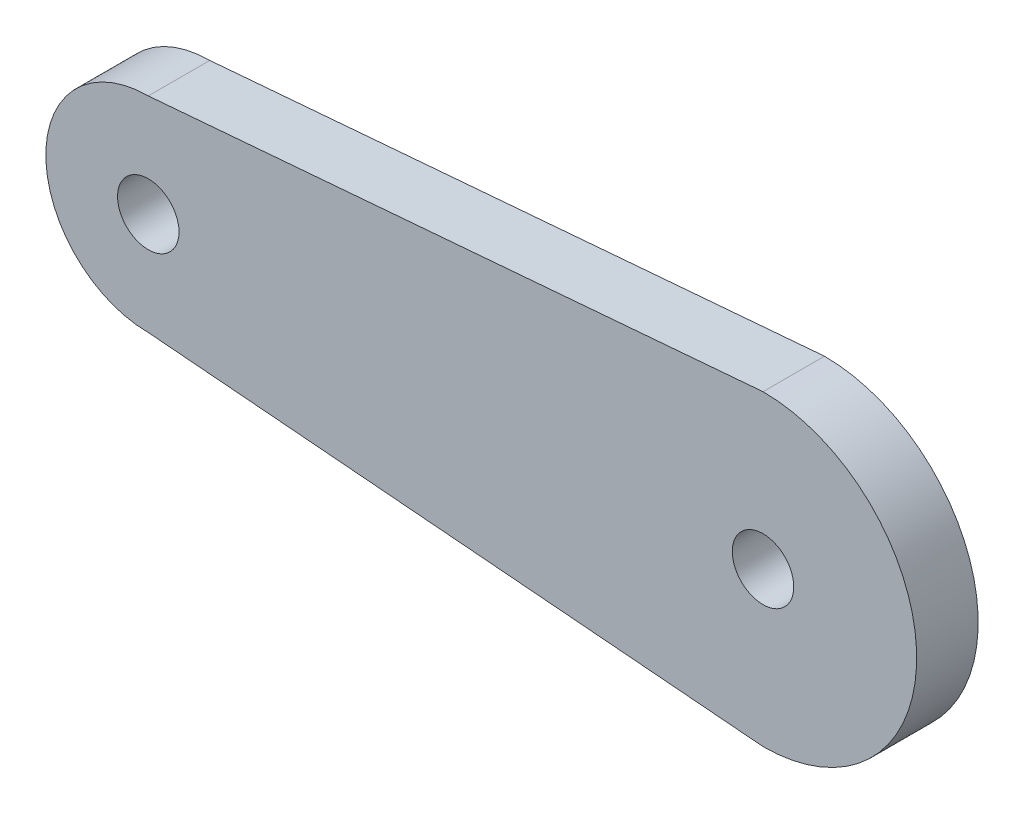
from build123d import *

# Parameters (mm, degrees)
SKETCH1_R           = 1.5
BOSS_EXTRUDE1_DEPTH = 3


with BuildPart() as part:
    # Sketch1 → Boss-Extrude1 (new body)
    with BuildSketch(Plane.XY):
        with BuildLine():
            ThreePointArc((30, 7.5), (37.5, 0), (30, -7.5))
            Line((30, -7.5), (0, -5))
            ThreePointArc((0, -5), (-5, 0), (0, 5))
            Line((0, 5), (30, 7.5))
        make_face()
        with Locations((30, 0)):
            Circle(SKETCH1_R, mode=Mode.SUBTRACT)
        Circle(SKETCH1_R, mode=Mode.SUBTRACT)
    extrude(amount=BOSS_EXTRUDE1_DEPTH)


solid = part.part
